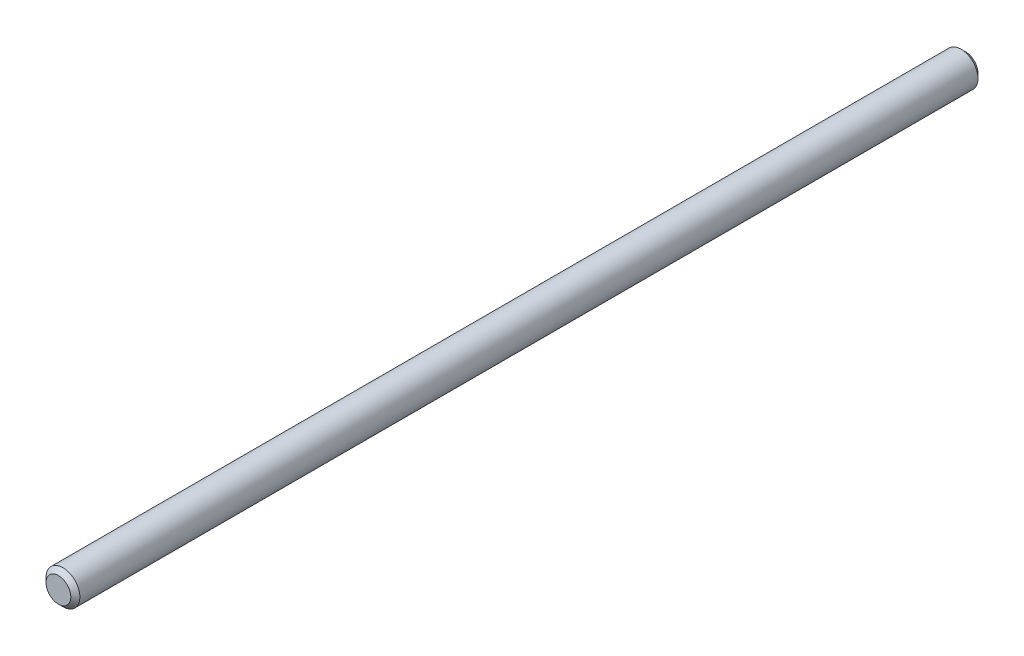
from build123d import *

# Parameters (mm, degrees)
SKETCH1_R      = 1.4224
EXTRUDE1_DEPTH = 76.2
CHAMFER1_SIZE  = 0.381


with BuildPart() as part:
    # Sketch1 → Extrude1 (new body)
    with BuildSketch(Plane.XY):
        Circle(SKETCH1_R)
    extrude(amount=-EXTRUDE1_DEPTH)

    # Chamfer1
    chamfer1_edges = [part.edges().sort_by_distance(p)[0] for p in [
        (-1.4224, 0, 0),
        (-1.4224, 0, -76.2),
    ]]
    chamfer(chamfer1_edges, length=CHAMFER1_SIZE)


solid = part.part
